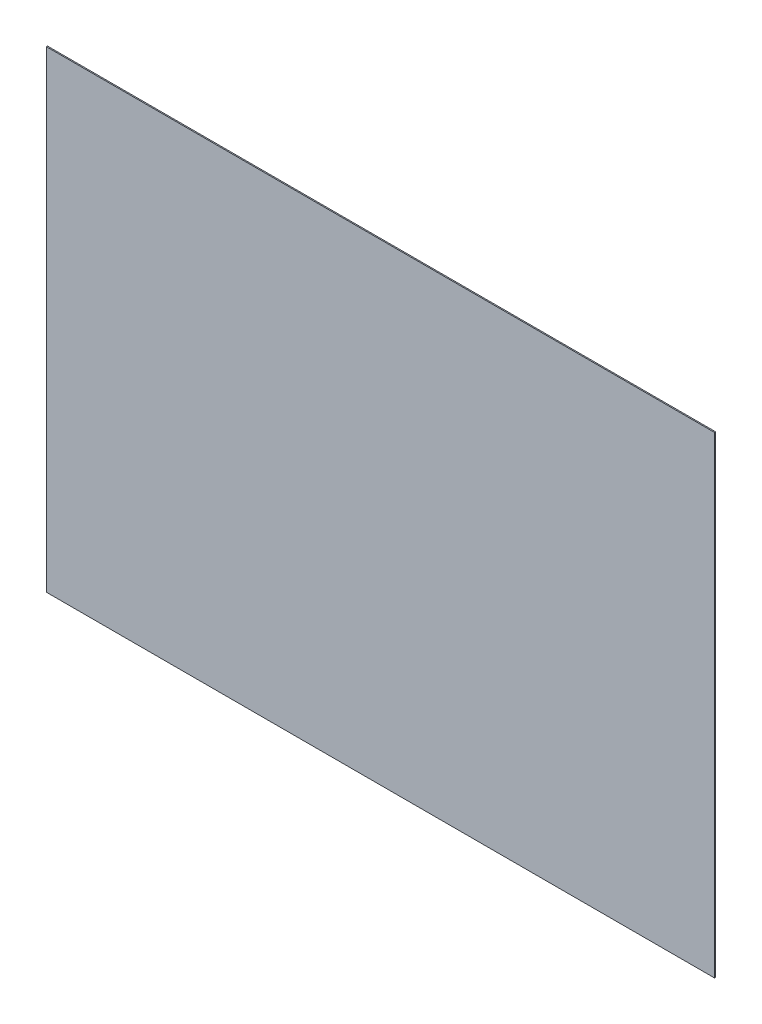
from build123d import *

# Parameters (mm, degrees)
CROQUIS1_W              = 297
CROQUIS1_H              = 210
SALIENTE_EXTRUIR1_DEPTH = 0.5


with BuildPart() as part:
    # Croquis1 → Saliente-Extruir1 (new body)
    with BuildSketch(Plane.XY):
        with Locations((148.5, 105)):
            Rectangle(CROQUIS1_W, CROQUIS1_H)
    extrude(amount=SALIENTE_EXTRUIR1_DEPTH)


solid = part.part
